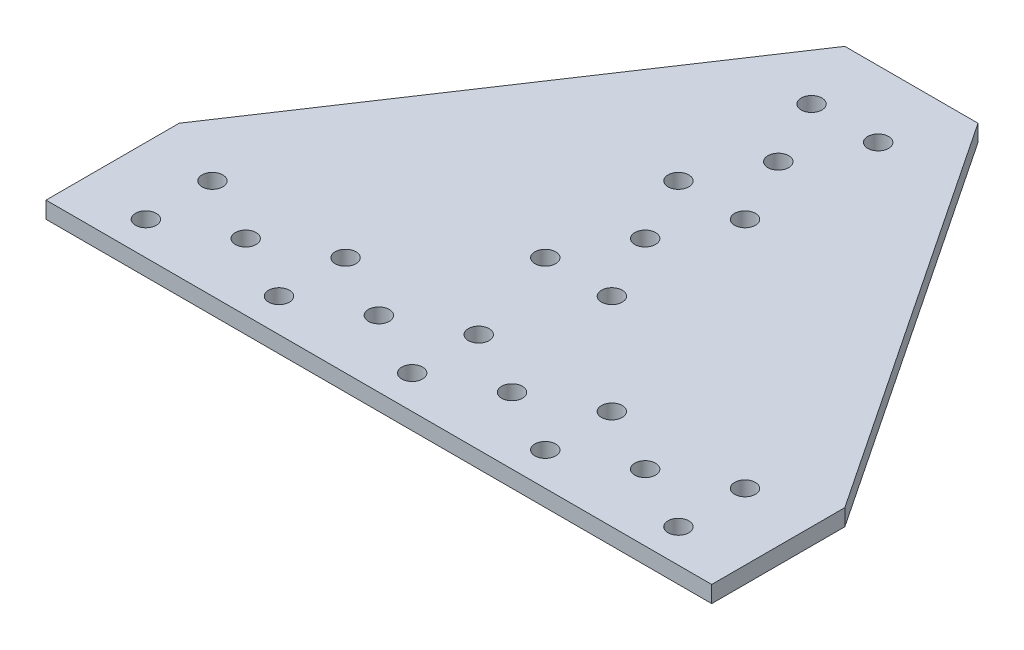
from build123d import *

# Parameters (mm, degrees)
SKETCH1_R           = 1.984375
BOSS_EXTRUDE1_DEPTH = 3.175


with BuildPart() as part:
    # Sketch1 → Boss-Extrude1 (new body)
    with BuildSketch(Plane(origin=(0, 0, 0), x_dir=(1, 0, 0), z_dir=(0, 1, 0))):
        Polygon((-12.7, 101.6), (12.7, 101.6), (63.5, 25.4), (63.5, 0), (-63.5, 0), (-63.5, 25.4), align=None)
        with Locations(Location((6.35, 88.9, 0), (0, 0, 270))):
            Circle(SKETCH1_R, mode=Mode.SUBTRACT)
        with Locations(Location((6.35, 63.5, 0), (0, 0, 270))):
            Circle(SKETCH1_R, mode=Mode.SUBTRACT)
        with Locations(Location((6.35, 38.1, 0), (0, 0, 270))):
            Circle(SKETCH1_R, mode=Mode.SUBTRACT)
        with Locations(Location((12.7, 12.7, 0), (0, 0, 270))):
            Circle(SKETCH1_R, mode=Mode.SUBTRACT)
        with Locations(Location((25.4, 6.35, 0), (0, 0, 270))):
            Circle(SKETCH1_R, mode=Mode.SUBTRACT)
        with Locations(Location((25.4, 19.05, 0), (0, 0, 270))):
            Circle(SKETCH1_R, mode=Mode.SUBTRACT)
        with Locations(Location((38.1, 12.7, 0), (0, 0, 270))):
            Circle(SKETCH1_R, mode=Mode.SUBTRACT)
        with Locations(Location((50.8, 6.35, 0), (0, 0, 270))):
            Circle(SKETCH1_R, mode=Mode.SUBTRACT)
        with Locations(Location((50.8, 19.05, 0), (0, 0, 270))):
            Circle(SKETCH1_R, mode=Mode.SUBTRACT)
        with Locations(Location((0, 76.2, 0), (0, 0, 90))):
            Circle(SKETCH1_R, mode=Mode.SUBTRACT)
        with Locations(Location((0, 50.8, 0), (0, 0, 90))):
            Circle(SKETCH1_R, mode=Mode.SUBTRACT)
        with Locations(Location((0, 19.05, 0), (0, 0, 90))):
            Circle(SKETCH1_R, mode=Mode.SUBTRACT)
        with Locations(Location((0, 6.35, 0), (0, 0, 90))):
            Circle(SKETCH1_R, mode=Mode.SUBTRACT)
        with Locations(Location((-50.8, 19.05, 0), (0, 0, 90))):
            Circle(SKETCH1_R, mode=Mode.SUBTRACT)
        with Locations(Location((-50.8, 6.35, 0), (0, 0, 90))):
            Circle(SKETCH1_R, mode=Mode.SUBTRACT)
        with Locations(Location((-38.1, 12.7, 0), (0, 0, 90))):
            Circle(SKETCH1_R, mode=Mode.SUBTRACT)
        with Locations(Location((-25.4, 19.05, 0), (0, 0, 90))):
            Circle(SKETCH1_R, mode=Mode.SUBTRACT)
        with Locations(Location((-25.4, 6.35, 0), (0, 0, 90))):
            Circle(SKETCH1_R, mode=Mode.SUBTRACT)
        with Locations(Location((-12.7, 12.7, 0), (0, 0, 90))):
            Circle(SKETCH1_R, mode=Mode.SUBTRACT)
        with Locations(Location((-6.35, 38.1, 0), (0, 0, 90))):
            Circle(SKETCH1_R, mode=Mode.SUBTRACT)
        with Locations(Location((-6.35, 63.5, 0), (0, 0, 90))):
            Circle(SKETCH1_R, mode=Mode.SUBTRACT)
        with Locations(Location((-6.35, 88.9, 0), (0, 0, 90))):
            Circle(SKETCH1_R, mode=Mode.SUBTRACT)
    extrude(amount=BOSS_EXTRUDE1_DEPTH)


solid = part.part
